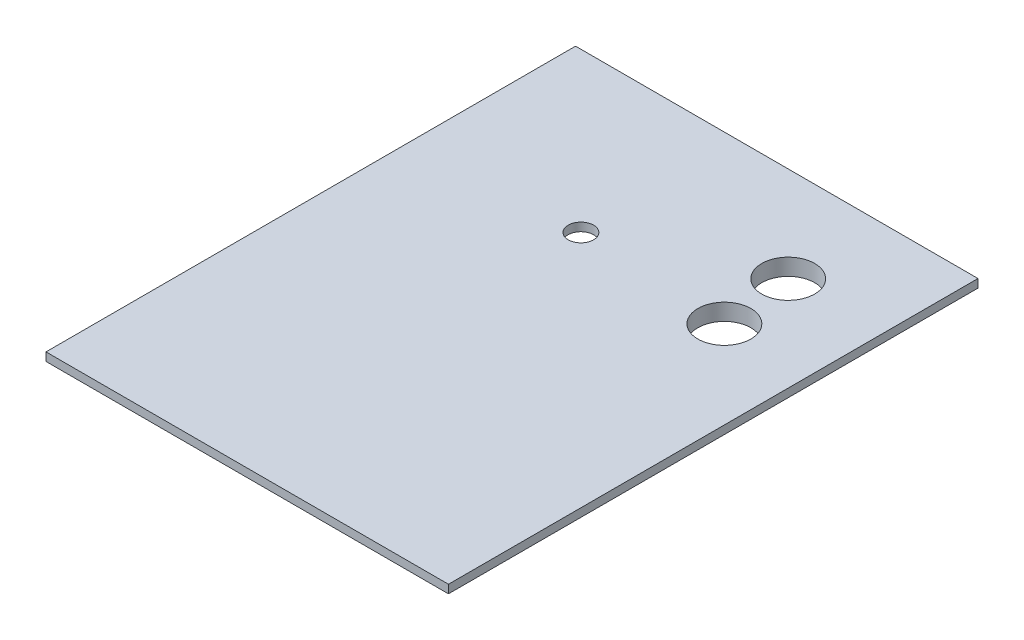
from build123d import *

# Parameters (mm, degrees)
SKETCH1_W               = 48.26
SKETCH1_H               = 63.5
BOSS_EXTRUDE1_DEPTH     = 1
SKETCH3_R               = 1.143
BOSS_EXTRUDE2_DEPTH     = 3
SKETCH4_R               = 2.524
SKETCH4_R_2             = 4.064
BOSS_EXTRUDE3_DEPTH     = 1
CUT_EXTRUDE1_DEPTH      = 80.814018819
CUT_EXTRUDE1_DEPTH_BACK = 80.814018819
SKETCH2_R               = 3.175
SKETCH2_R_2             = 1.524


with BuildPart() as part:
    # Sketch1 → Boss-Extrude1 (new body)
    with BuildSketch(Plane(origin=(0, -11.34264997, 0), x_dir=(1, 0, 0), z_dir=(0, 1, 0))):
        with Locations((24.13, -31.75)):
            Rectangle(SKETCH1_W, SKETCH1_H)
    extrude(amount=BOSS_EXTRUDE1_DEPTH)

    # Sketch3 → Boss-Extrude2 (add)
    with BuildSketch(Plane.XZ.offset(11.34264997)):
        with Locations(Location((5.0673, 58.34634, 0), (0, 0, 90))):
            Circle(SKETCH3_R)
        with Locations(Location((27.31008, 5.72008, 0), (0, 0, 90))):
            Circle(SKETCH3_R)
    extrude(amount=BOSS_EXTRUDE2_DEPTH)

    # Sketch4 → Boss-Extrude3 (add)
    with BuildSketch(Plane.XZ.offset(11.34264997)):
        with Locations(Location((5.0673, 58.34634, 0), (0, 0, 90))):
            Circle(SKETCH4_R)
        with Locations(Location((37.75456, 19.90598, 0), (0, 0, 90))):
            Circle(SKETCH4_R_2)
        with Locations(Location((36.9062, 11.4046, 0), (0, 0, 90))):
            Circle(SKETCH4_R_2)
        with Locations(Location((27.31008, 5.72008, 0), (0, 0, 90))):
            Circle(SKETCH4_R)
    extrude(amount=BOSS_EXTRUDE3_DEPTH)

    # Sketch2 → Cut-Extrude1 (cut, two sides: drawn at the far end of the back side and taken through both)
    with BuildSketch(Plane.XZ.offset(11.34264997).offset(-CUT_EXTRUDE1_DEPTH_BACK)):
        with Locations(Location((37.75456, 19.90598, 0), (0, 0, 270))):
            Circle(SKETCH2_R)
        with Locations(Location((36.9062, 11.4046, 0), (0, 0, 270))):
            Circle(SKETCH2_R)
        with Locations(Location((19.6723, 19.02714, 0), (0, 0, 270))):
            Circle(SKETCH2_R_2)
    extrude(amount=CUT_EXTRUDE1_DEPTH + CUT_EXTRUDE1_DEPTH_BACK, mode=Mode.SUBTRACT)


solid = part.part
